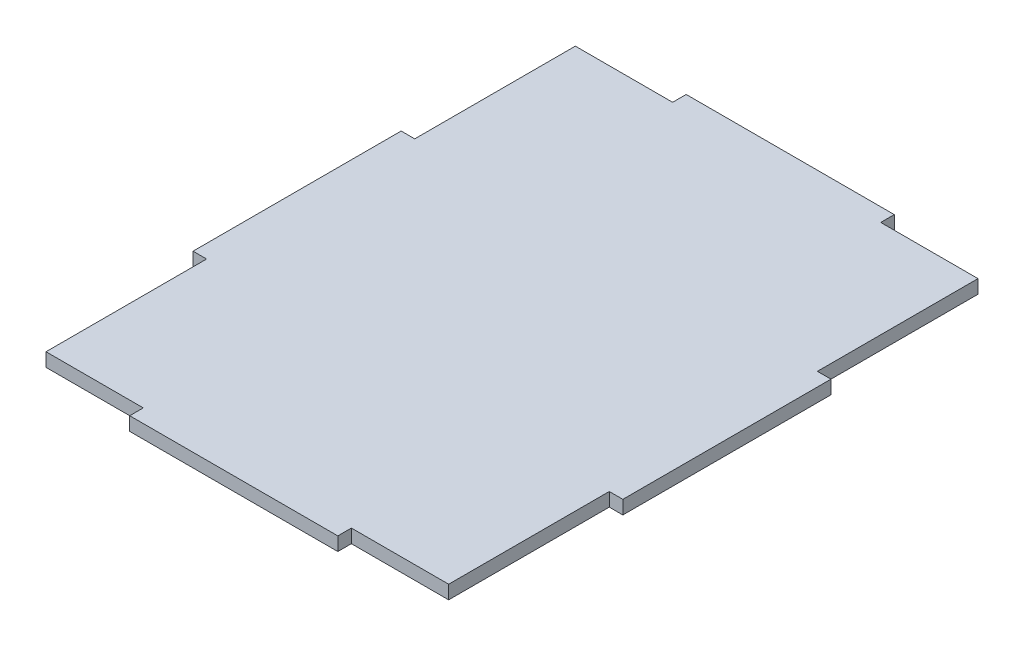
from build123d import *

# Parameters (mm, degrees)
SALIENTE_EXTRUIR1_DEPTH = 3


with BuildPart() as part:
    # Croquis1 → Saliente-Extruir1 (new body)
    with BuildSketch(Plane(origin=(0, 0, 0), x_dir=(1, 0, 0), z_dir=(0, 1, 0))):
        Polygon((3, 38.5), (3, 3), (24.5, 3), (24.5, 0), (70.5, 0), (70.5, 3), (92, 3), (92, 38.5), (95, 38.5), (95, 84.5), (92, 84.5), (92, 120), (70.5, 120), (70.5, 123), (24.5, 123), (24.5, 120), (3, 120), (3, 84.5), (0, 84.5), (0, 38.5), align=None)
    extrude(amount=SALIENTE_EXTRUIR1_DEPTH)


solid = part.part
